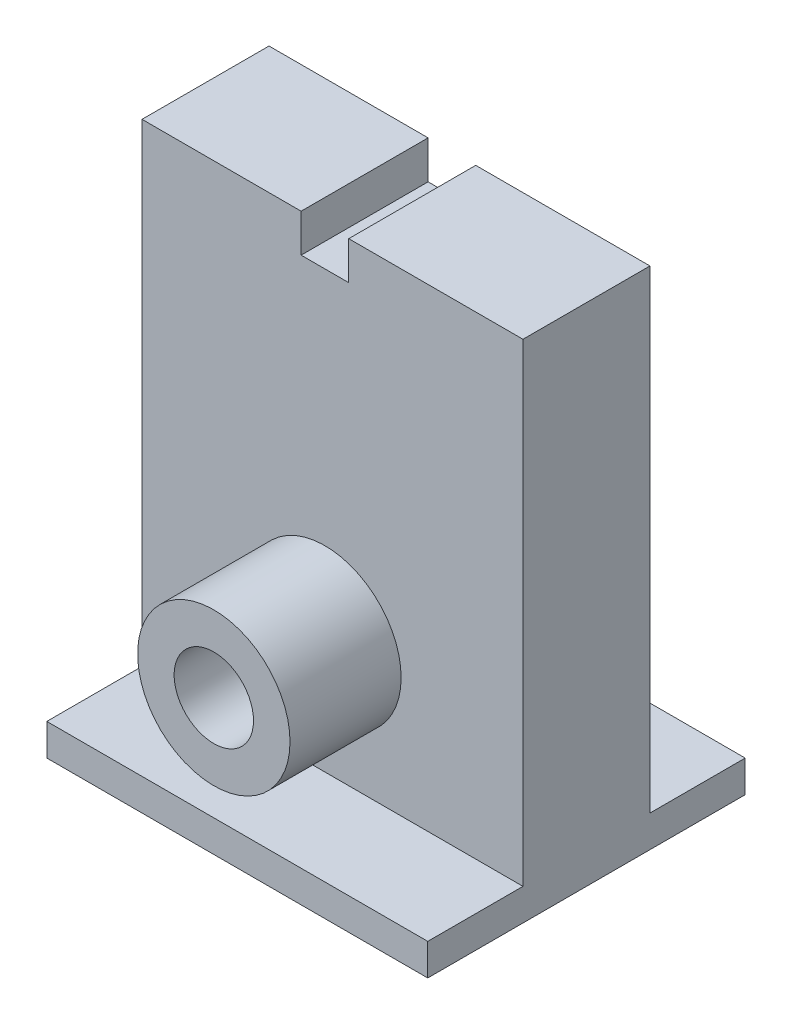
from build123d import *

# Parameters (mm, degrees)
SKETCH_1_W      = 120
SKETCH_1_H      = 147.25
EXTRUDE_1_DEPTH = 40
SKETCH_2_W      = 50.114502488
SKETCH_2_H      = 40
SKETCH_2_W_2    = 54.885497512
EXTRUDE_2_DEPTH = 12
SKETCH_3_R      = 24
SKETCH_3_R_2    = 12.5
EXTRUDE_3_DEPTH = 35
SKETCH_4_W      = 120
SKETCH_4_H      = 100
EXTRUDE_4_DEPTH = 10


with BuildPart() as part:
    # 草图1 → 凸台-拉伸1 (new body)
    with BuildSketch(Plane.XY):
        with Locations((2.385497512, -49.600771144)):
            Rectangle(SKETCH_1_W, SKETCH_1_H)
    extrude(amount=EXTRUDE_1_DEPTH)

    # 草图2 → 凸台-拉伸2 (add)
    with BuildSketch(Plane(origin=(0, 24.024228856, 0), x_dir=(1, 0, 0), z_dir=(0, 1, 0))):
        with Locations((-32.557251244, -20)):
            Rectangle(SKETCH_2_W, SKETCH_2_H)
        with Locations((34.942748756, -20)):
            Rectangle(SKETCH_2_W_2, SKETCH_2_H)
    extrude(amount=EXTRUDE_2_DEPTH)

    # 草图3 → 凸台-拉伸3 (add)
    with BuildSketch(Plane.XY.offset(40)):
        with Locations((0, -75.475771144)):
            Circle(SKETCH_3_R)
        with Locations((0, -75.475771144)):
            Circle(SKETCH_3_R_2, mode=Mode.SUBTRACT)
    extrude_3 = extrude(amount=EXTRUDE_3_DEPTH)

    # 镜向1: 凸台-拉伸3 across plane
    add(extrude_3.mirror(Plane.XY.offset(20)))

    # 草图4 → 凸台-拉伸4 (add)
    with BuildSketch(Plane.XZ.offset(123.225771144)):
        with Locations((2.385497512, 20)):
            Rectangle(SKETCH_4_W, SKETCH_4_H)
    extrude(amount=-EXTRUDE_4_DEPTH)


solid = part.part
